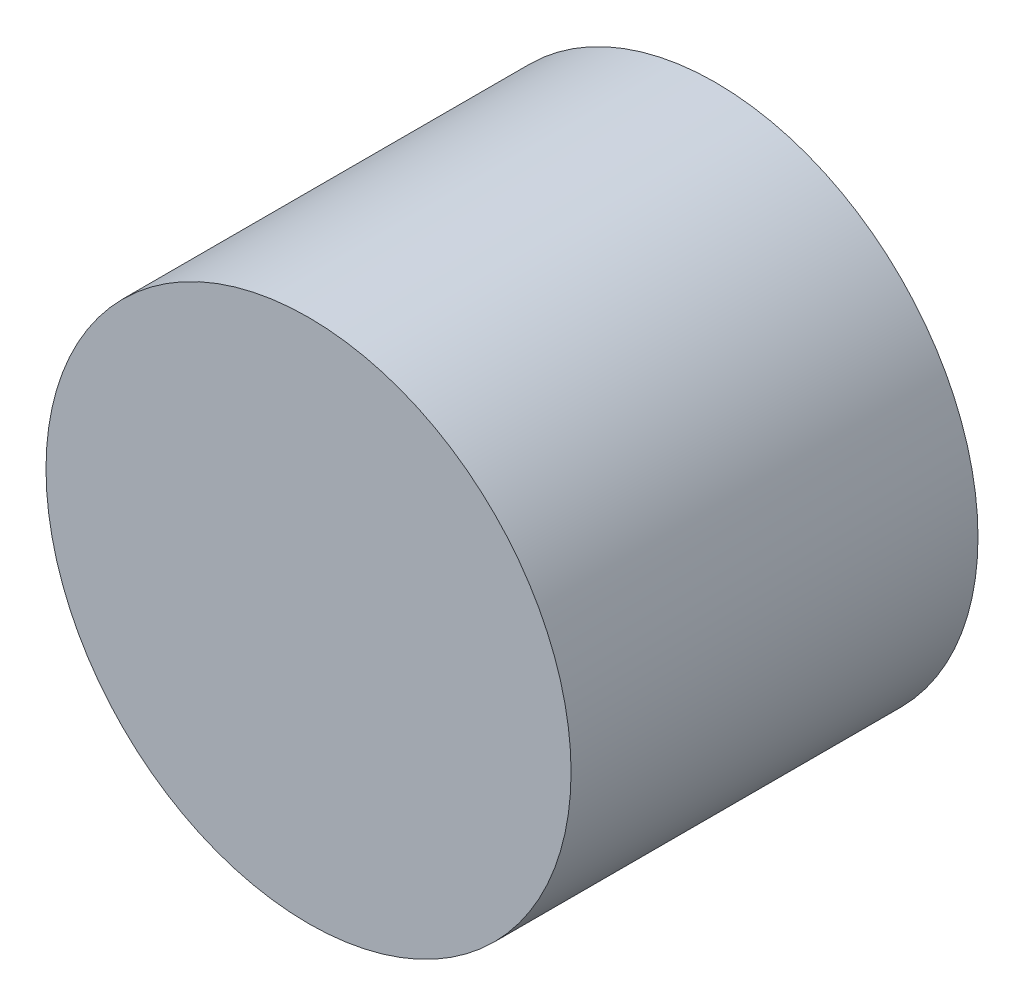
from build123d import *

# Parameters (mm, degrees)
SKETCH_1_R      = 60
SKETCH_1_R_2    = 57
EXTRUDE_1_DEPTH = 90
SKETCH_2_R      = 60
EXTRUDE_2_DEPTH = 3


with BuildPart() as part:
    # 스케치1 → 보스-돌출1 (new body)
    with BuildSketch(Plane.XY):
        with Locations(Location((0, 0, 0), (0, 0, 180))):
            Circle(SKETCH_1_R)
        with Locations(Location((0, 0, 0), (0, 0, 180))):
            Circle(SKETCH_1_R_2, mode=Mode.SUBTRACT)
    extrude(amount=EXTRUDE_1_DEPTH)

    # 스케치2 → 보스-돌출2 (add)
    with BuildSketch(Plane.XY.offset(90)):
        with Locations(Location((0, 0, 0), (0, 0, 180))):
            Circle(SKETCH_2_R)
    extrude(amount=EXTRUDE_2_DEPTH)


solid = part.part
